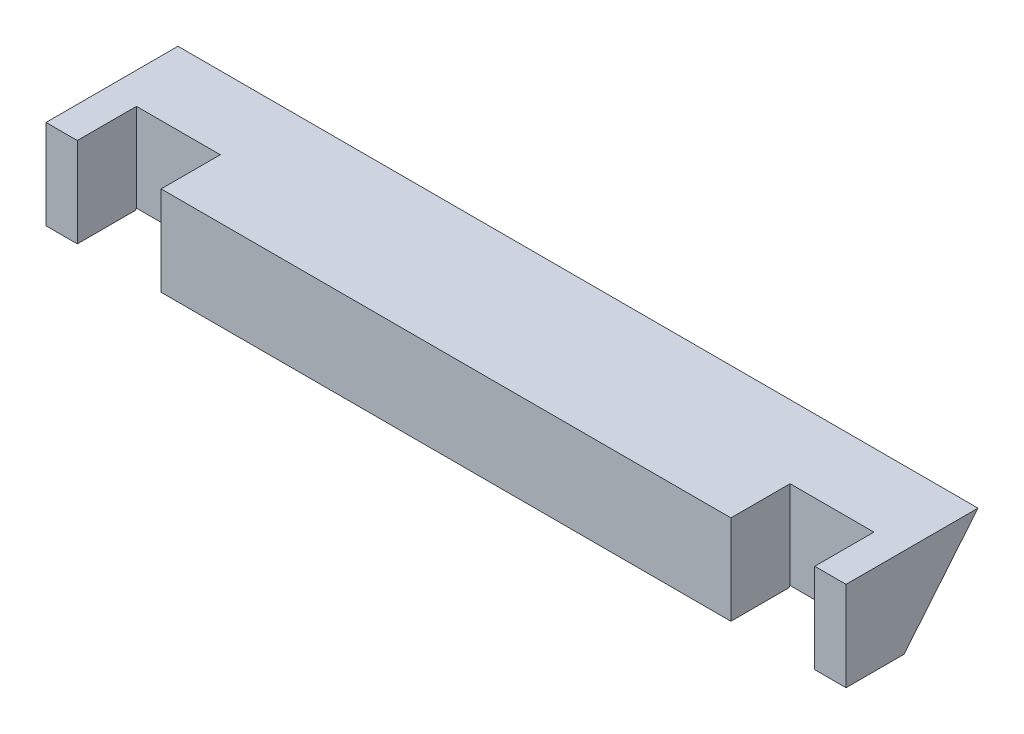
from build123d import *

# Parameters (mm, degrees)
EXTRUDE_1_DEPTH     = 695
SKETCH_2_W          = 695
SKETCH_2_H          = 77.81
EXTRUDE_2_DEPTH     = 50.41
SKETCH_9_W          = 72.82
SKETCH_9_H          = 51.4
CUT_EXTRUDE_3_DEPTH = 1000
SKETCH_10_W         = 72.82
SKETCH_10_H         = 51.4
CUT_EXTRUDE_4_DEPTH = 1000


with BuildPart() as part:
    # 草图1 → 凸台-拉伸1 (new body)
    with BuildSketch(Plane(origin=(0, 0, 0), x_dir=(0, 0, -1), z_dir=(1, 0, 0))):
        Polygon((51.711180709, 31.822265051), (-12.508819291, 31.822265051), (-12.508819291, -45.987734949), align=None)
    extrude(amount=EXTRUDE_1_DEPTH)

    # 草图2 → 凸台-拉伸2 (add)
    with BuildSketch(Plane.XY.offset(12.508819291)):
        with Locations((347.5, -7.082734949)):
            Rectangle(SKETCH_2_W, SKETCH_2_H)
    extrude(amount=EXTRUDE_2_DEPTH)

    # 草图9 → 切除-拉伸3 (cut)
    with BuildSketch(Plane(origin=(0, 31.822265051, 0), x_dir=(1, 0, 0), z_dir=(0, 1, 0))):
        with Locations((63.6, -37.218819291)):
            Rectangle(SKETCH_9_W, SKETCH_9_H)
    extrude(amount=-CUT_EXTRUDE_3_DEPTH, mode=Mode.SUBTRACT)

    # 草图10 → 切除-拉伸4 (cut)
    with BuildSketch(Plane(origin=(0, 31.822265051, 0), x_dir=(1, 0, 0), z_dir=(0, 1, 0))):
        with Locations((631.4, -37.218819291)):
            Rectangle(SKETCH_10_W, SKETCH_10_H)
    extrude(amount=-CUT_EXTRUDE_4_DEPTH, mode=Mode.SUBTRACT)


solid = part.part
